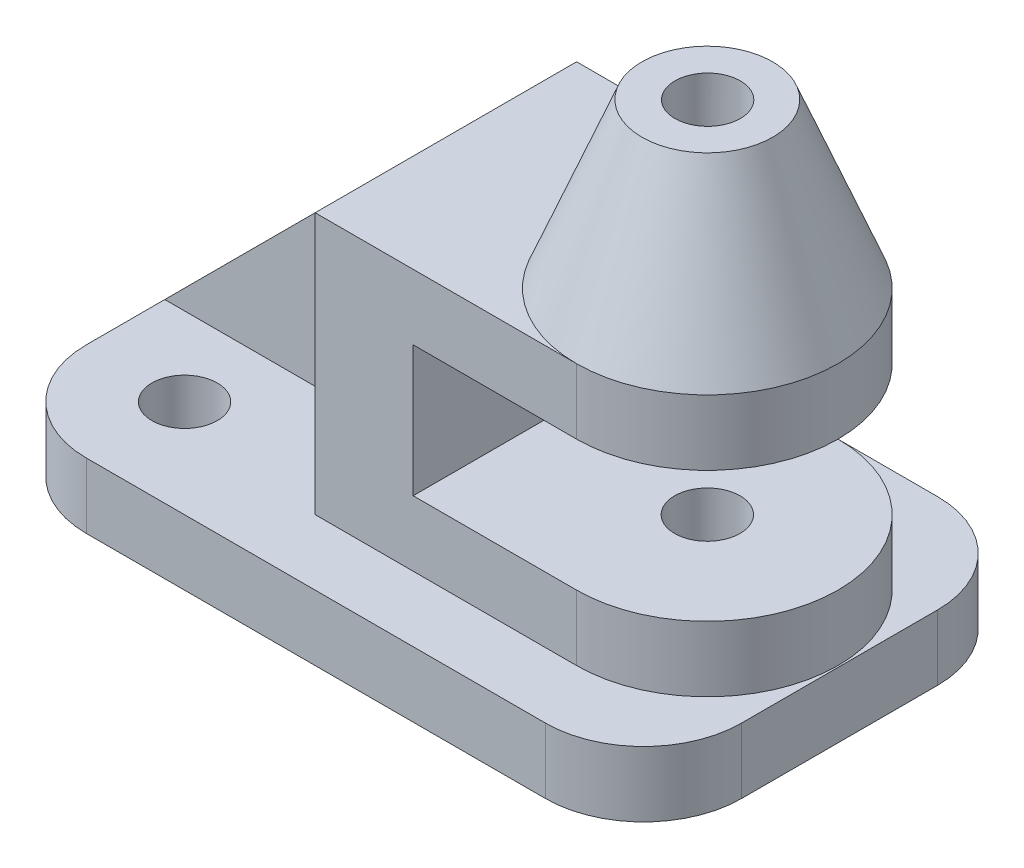
from build123d import *

# Parameters (mm, degrees)
BOSS_EXTRUDE4_DEPTH = 10
SKETCH4_R           = 5
CUT_EXTRUDE2_DEPTH  = 10
BOSS_EXTRUDE5_DEPTH = 40
SKETCH6_R           = 5
CUT_EXTRUDE4_DEPTH  = 60
SKETCH7_W           = 45
SKETCH7_H           = 20
CUT_EXTRUDE5_DEPTH  = 40
RIB1_REACH          = 78.889
SKETCH8_WALL_W      = 212.346557286
SKETCH8_WALL_H      = 6
SKETCH9_R           = 20
BOSS_EXTRUDE7_DEPTH = 25
BOSS_EXTRUDE7_TAPER = 21.8
SKETCH15_R          = 5
CUT_EXTRUDE6_DEPTH  = 25


with BuildPart() as part:
    # Sketch1 → Boss-Extrude4 (new body)
    with BuildSketch(Plane(origin=(0, 0, 0), x_dir=(1, 0, 0), z_dir=(0, 1, 0))):
        with BuildLine():
            Line((-35.119052847, -30), (35.119052847, -30))
            ThreePointArc((35.119052847, -30), (45.725654565, -25.606601718), (50.119052847, -15))
            Line((50.119052847, -15), (50.119052847, 15))
            ThreePointArc((50.119052847, 15), (45.725654565, 25.606601718), (35.119052847, 30))
            Line((35.119052847, 30), (-35.119052847, 30))
            ThreePointArc((-35.119052847, 30), (-45.725654565, 25.606601718), (-50.119052847, 15))
            Line((-50.119052847, 15), (-50.119052847, -15))
            ThreePointArc((-50.119052847, -15), (-45.725654565, -25.606601718), (-35.119052847, -30))
        make_face()
    extrude(amount=BOSS_EXTRUDE4_DEPTH)

    # Sketch4 → Cut-Extrude2 (cut)
    with BuildSketch(Plane(origin=(0, 10, 0), x_dir=(1, 0, 0), z_dir=(0, 1, 0))):
        with Locations(Location((-35.054653665, 15.038511516, 0), (0, 0, 270))):
            Circle(SKETCH4_R)
        with Locations(Location((-35.054653665, -15.038511516, 0), (0, 0, 90))):
            Circle(SKETCH4_R)
    extrude(amount=-CUT_EXTRUDE2_DEPTH, mode=Mode.SUBTRACT)

    # Sketch5 → Boss-Extrude5 (add)
    with BuildSketch(Plane(origin=(0, 10, 0), x_dir=(1, 0, 0), z_dir=(0, 1, 0))):
        with BuildLine():
            Line((-10.119052847, -20), (-10.119052847, 20))
            Line((-10.119052847, 20), (29.880947153, 20))
            ThreePointArc((29.880947153, 20), (49.880947153, 0), (29.880947153, -20))
            Line((29.880947153, -20), (-10.119052847, -20))
        make_face()
    extrude(amount=BOSS_EXTRUDE5_DEPTH)

    # Sketch6 → Cut-Extrude4 (cut)
    with BuildSketch(Plane(origin=(0, 50, 0), x_dir=(1, 0, 0), z_dir=(0, 1, 0))):
        with Locations(Location((29.880947153, 0, 0), (0, 0, 270))):
            Circle(SKETCH6_R)
    extrude(amount=-CUT_EXTRUDE4_DEPTH, mode=Mode.SUBTRACT)

    # Sketch7 → Cut-Extrude5 (cut)
    with BuildSketch(Plane.XY.offset(20)):
        with Locations((27.380947153, 30)):
            Rectangle(SKETCH7_W, SKETCH7_H)
    extrude(amount=-CUT_EXTRUDE5_DEPTH, mode=Mode.SUBTRACT)

    # Sketch8 wall → Rib1 (add, up to next)
    with BuildSketch(Plane(origin=(-30.119052847, 30, 0), x_dir=(0.707106781187, 0.707106781187, 0), z_dir=(-0.707106781187, 0.707106781187, 0)), mode=Mode.PRIVATE) as rib1_sk1:
        Rectangle(SKETCH8_WALL_W, SKETCH8_WALL_H)
    rib1_tool1 = extrude(rib1_sk1.sketch, amount=-RIB1_REACH, mode=Mode.PRIVATE) - part.part
    add(rib1_tool1.solids().sort_by_distance((-30.119052847, 30, 0))[0])

    # Sketch9 → Boss-Extrude7 (add)
    with BuildSketch(Plane(origin=(0, 50, 0), x_dir=(1, 0, 0), z_dir=(0, 1, 0))):
        with Locations((29.880947153, 0)):
            Circle(SKETCH9_R)
    extrude(amount=BOSS_EXTRUDE7_DEPTH, taper=BOSS_EXTRUDE7_TAPER)

    # Sketch15 → Cut-Extrude6 (cut)
    with BuildSketch(Plane(origin=(0, 75, 0), x_dir=(1, 0, 0), z_dir=(0, 1, 0))):
        with Locations(Location((29.9308784, 0, 0), (0, 0, 270))):
            Circle(SKETCH15_R)
    extrude(amount=-CUT_EXTRUDE6_DEPTH, mode=Mode.SUBTRACT)


solid = part.part
